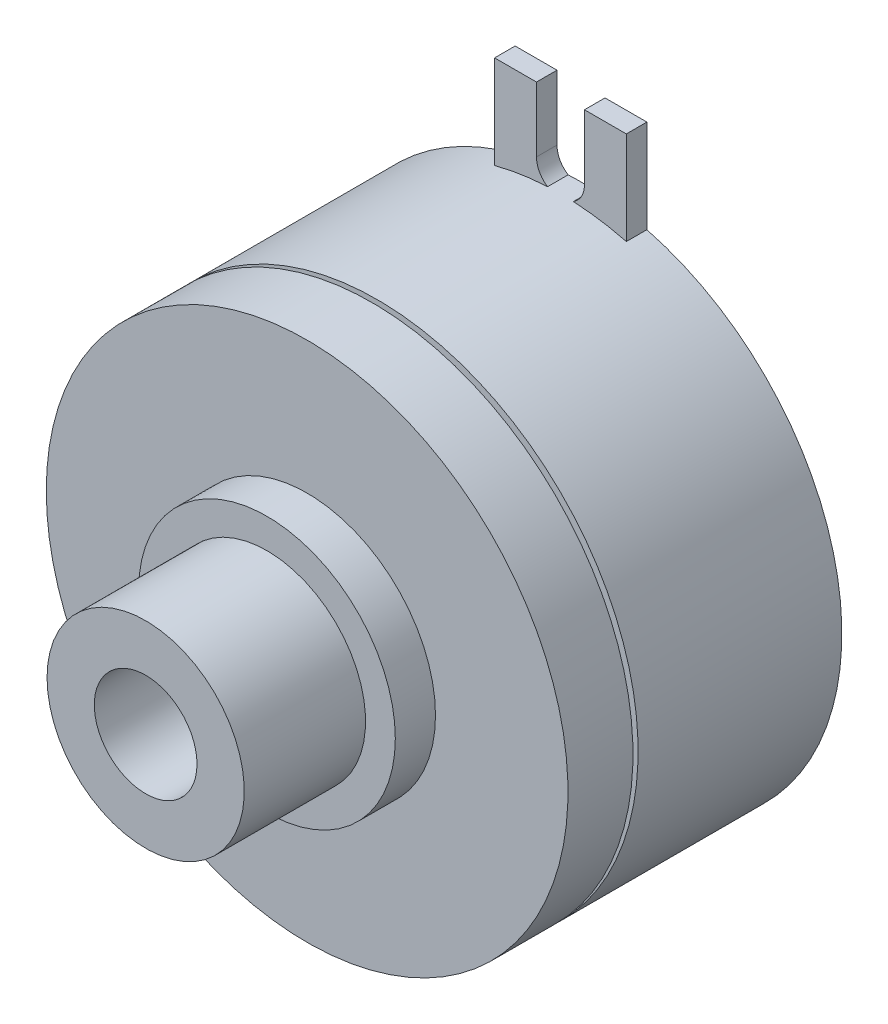
from build123d import *

# Parameters (mm, degrees)
SKETCH1_R           = 9.61
BOSS_EXTRUDE1_DEPTH = 7.087
SKETCH2_R           = 25.4
BOSS_EXTRUDE2_DEPTH = 26.67
SKETCH3_R           = 12.5
BOSS_EXTRUDE3_DEPTH = 3.911
SKETCH4_R           = 9.601
BOSS_EXTRUDE4_DEPTH = 11.811
BOSS_EXTRUDE5_DEPTH = 2
SKETCH5_R           = 5
CUT_EXTRUDE1_DEPTH  = 66.007618523
SKETCH7_OUTSIDE_W   = 71.256
SKETCH7_OUTSIDE_H   = 79.511
SKETCH7_OUTSIDE_R   = 18.771401146
CUT_EXTRUDE2_DEPTH  = 0.5


with BuildPart() as part:
    # Sketch1 → Boss-Extrude1 (new body)
    with BuildSketch(Plane.XY):
        with Locations(Location((0, 0, 0), (0, 0, 180))):
            Circle(SKETCH1_R)
    extrude(amount=BOSS_EXTRUDE1_DEPTH)

    # Sketch2 → Boss-Extrude2 (add)
    with BuildSketch(Plane.XY.offset(7.087)):
        Circle(SKETCH2_R)
    extrude(amount=BOSS_EXTRUDE2_DEPTH)

    # Sketch3 → Boss-Extrude3 (add)
    with BuildSketch(Plane.XY.offset(33.757)):
        Circle(SKETCH3_R)
    extrude(amount=BOSS_EXTRUDE3_DEPTH)

    # Sketch4 → Boss-Extrude4 (add)
    with BuildSketch(Plane.XY.offset(37.668)):
        Circle(SKETCH4_R)
    extrude(amount=BOSS_EXTRUDE4_DEPTH)

    # Sketch6 → Boss-Extrude5 (add)
    with BuildSketch(Plane(origin=(0, 0, 7.087), x_dir=(-1, 0, 0), z_dir=(0, 0, -1))):
        with BuildLine():
            Line((-6.4135, 33.655), (-2.337, 33.655))
            Line((-2.337, 33.655), (-2.337, 27.34))
            ThreePointArc((-2.337, 27.34), (0, 25.003), (2.337, 27.34))
            Line((2.337, 27.34), (2.337, 33.655))
            Line((2.337, 33.655), (6.4135, 33.655))
            Line((6.4135, 33.655), (6.4135, 24.576961117))
            ThreePointArc((6.4135, 24.576961117), (0, -25.4), (-6.4135, 24.576961117))
            Line((-6.4135, 24.576961117), (-6.4135, 33.655))
        make_face()
    extrude(amount=-BOSS_EXTRUDE5_DEPTH)

    # Sketch5 → Cut-Extrude1 (cut, through all)
    with BuildSketch(Plane.XY.offset(49.479)):
        Circle(SKETCH5_R)
    extrude(amount=-CUT_EXTRUDE1_DEPTH, mode=Mode.SUBTRACT)

    # Sketch7 outside → Cut-Extrude2 (cut)
    with BuildSketch(Plane(origin=(0, 0, 26.927), x_dir=(-1, 0, 0), z_dir=(0, 0, -1))):
        with Locations((0, 4.1275)):
            Rectangle(SKETCH7_OUTSIDE_W, SKETCH7_OUTSIDE_H)
        Circle(SKETCH7_OUTSIDE_R, mode=Mode.SUBTRACT)
    extrude(amount=-CUT_EXTRUDE2_DEPTH, mode=Mode.SUBTRACT)


solid = part.part
